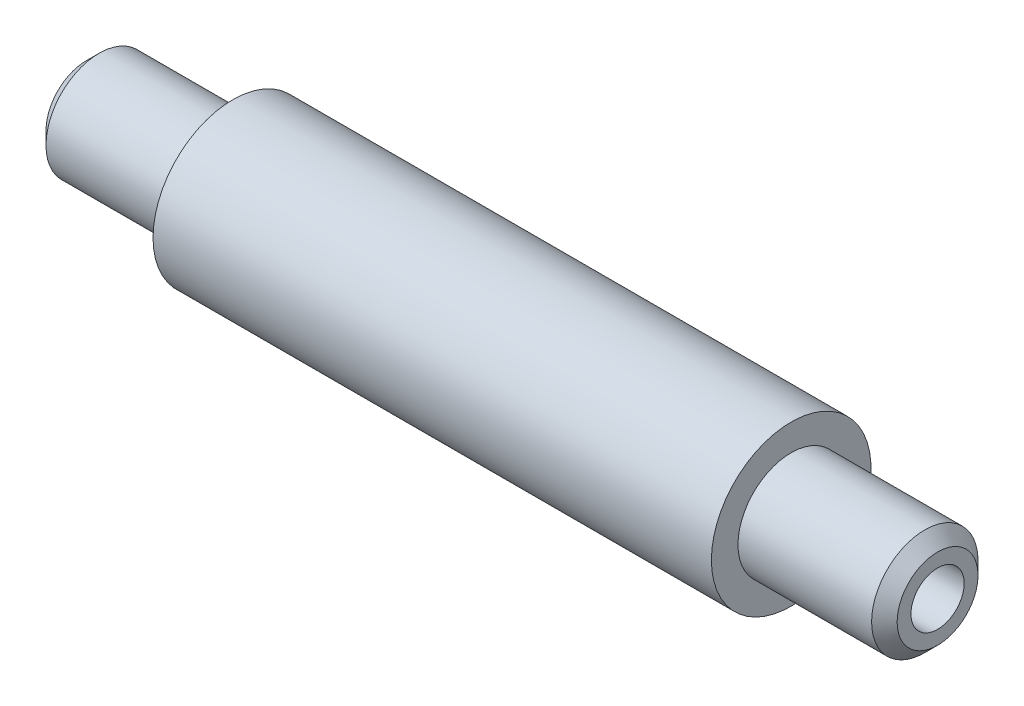
from build123d import *


with BuildPart() as part:
    # Sketch2 → Revolve1 (revolve)
    with BuildSketch(Plane.XY, mode=Mode.PRIVATE) as revolve1_sk:
        Polygon((-50.8, 3.175), (50.8, 3.175), (50.8, 4.826), (49.276, 6.35), (33.3248, 6.35), (33.3248, 9.525), (-33.3248, 9.525), (-33.3248, 6.35), (-49.276, 6.35), (-50.8, 4.826), align=None)
    revolve(revolve1_sk.sketch.rotate(Axis((-50.686859688, 0, 0), (1, 0, 0)), 90), axis=Axis((-50.686859688, 0, 0), (1, 0, 0)))


solid = part.part
